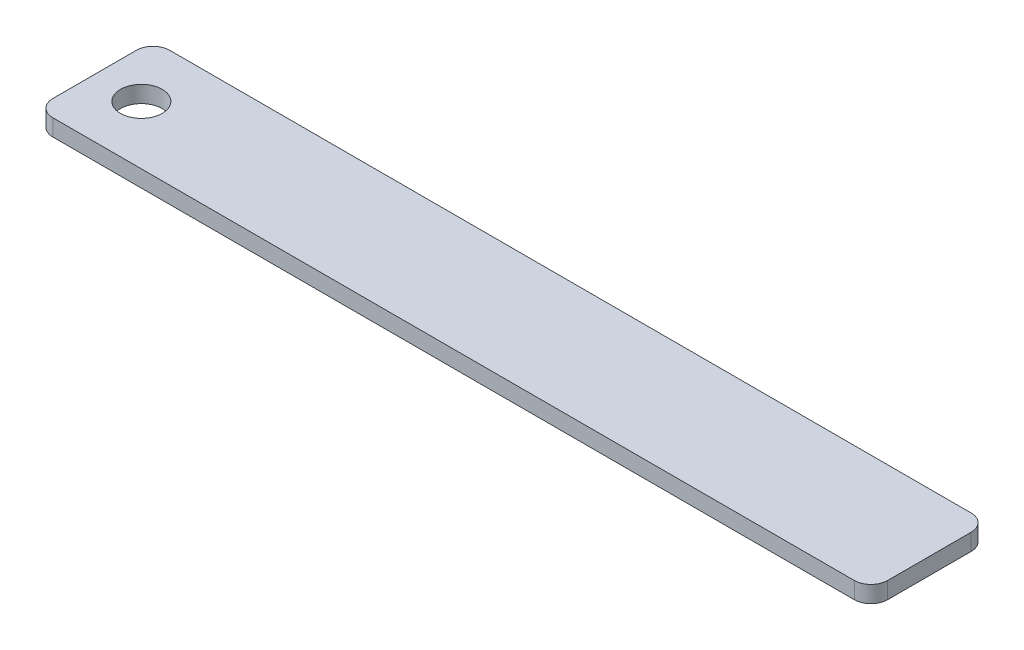
from build123d import *

# Parameters (mm, degrees)
SKETCH1_W           = 63.5
SKETCH1_H           = 8.89
SKETCH1_R           = 1.5875
BOSS_EXTRUDE1_DEPTH = 1.27
FILLET1_R           = 1.27


with BuildPart() as part:
    # Sketch1 → Boss-Extrude1 (new body)
    with BuildSketch(Plane(origin=(0, 0, 0), x_dir=(1, 0, 0), z_dir=(0, 1, 0))):
        Rectangle(SKETCH1_W, SKETCH1_H)
        with Locations(Location((-28.194, 0, 0), (0, 0, 270))):
            Circle(SKETCH1_R, mode=Mode.SUBTRACT)
    extrude(amount=BOSS_EXTRUDE1_DEPTH)

    # Fillet1
    fillet1_edges = [part.edges().sort_by_distance(p)[0] for p in [
        (31.75, 0.635, 4.445),
        (-31.75, 0.635, 4.445),
        (-31.75, 0.635, -4.445),
        (31.75, 0.635, -4.445),
    ]]
    fillet(fillet1_edges, radius=FILLET1_R)


solid = part.part
